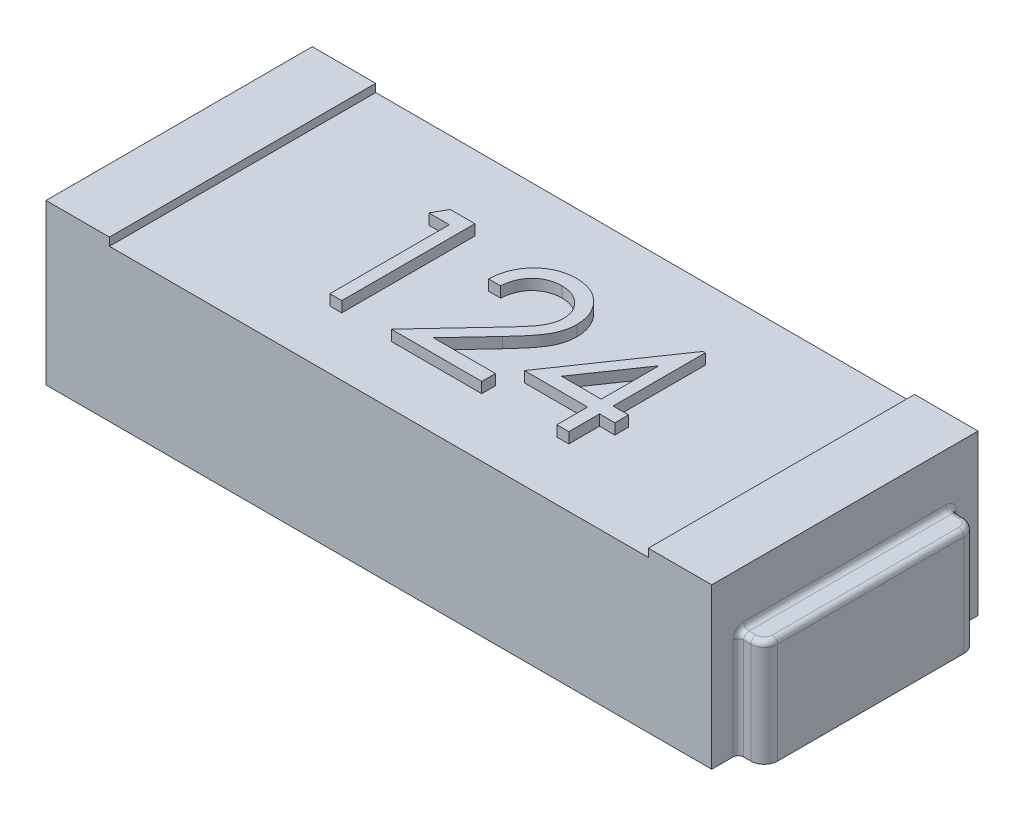
from build123d import *

# Parameters (mm, degrees)
ESQUISSE1_W             = 2.5
ESQUISSE1_H             = 1
BOSS_EXTRU_1_DEPTH      = 0.6
ESQUISSE2_W             = 2.023603034
ESQUISSE2_H             = 1
ENL_V_MAT_EXTRU_1_DEPTH = 0.03
BOSS_EXTRU_2_DEPTH      = 0.4
CONG_1_R                = 0.02
CONG_1_OF_SYM_TRIE2_R   = 0.02
BOSS_EXTRU_3_DEPTH      = 0.04


with BuildPart() as part:
    # Esquisse1 → Boss.-Extru.1 (new body)
    with BuildSketch(Plane(origin=(0, 0, 0), x_dir=(1, 0, 0), z_dir=(0, 1, 0))):
        Rectangle(ESQUISSE1_W, ESQUISSE1_H)
    extrude(amount=BOSS_EXTRU_1_DEPTH)

    # Esquisse2 → Enlèv. mat.-Extru.1 (cut)
    with BuildSketch(Plane(origin=(0, 0.6, 0), x_dir=(1, 0, 0), z_dir=(0, 1, 0))):
        Rectangle(ESQUISSE2_W, ESQUISSE2_H)
    extrude(amount=-ENL_V_MAT_EXTRU_1_DEPTH, mode=Mode.SUBTRACT)

    # Esquisse3 → Boss.-Extru.2 (add)
    with BuildSketch(Plane(origin=(0, 0, 0), x_dir=(1, 0, 0), z_dir=(0, 1, 0))):
        with BuildLine():
            Line((1.25, 0.4), (1.297141448, 0.4))
            ThreePointArc((1.297141448, 0.4), (1.332496787, 0.385355339), (1.347141448, 0.35))
            Line((1.347141448, 0.35), (1.347141448, -0.35))
            ThreePointArc((1.347141448, -0.35), (1.332496787, -0.385355339), (1.297141448, -0.4))
            Line((1.297141448, -0.4), (1.25, -0.4))
            Line((1.25, -0.4), (1.25, 0.4))
        make_face()
    boss_extru_2 = extrude(amount=BOSS_EXTRU_2_DEPTH)

    # Congé1
    cong_1_edges = [part.edges().sort_by_distance(p)[0] for p in [
        (1.25, 0.2, -0.4),
        (1.25, 0.2, 0.4),
        (1.25, 0.4, 0),
        (1.273570724, 0.4, 0.4),
        (1.332496787, 0.4, 0.385355339),
        (1.347141448, 0.4, 0),
        (1.332496787, 0.4, -0.385355339),
        (1.273570724, 0.4, -0.4),
    ]]
    fillet(cong_1_edges, radius=CONG_1_R)

    # Symétrie2: Boss.-Extru.2 across plane
    add(boss_extru_2.mirror(Plane(origin=(0, 0, 0), x_dir=(0, 0, 1), z_dir=(1, 0, 0))))

    # Congé1 of Symétrie2
    cong_1_of_sym_trie2_edges = [part.edges().sort_by_distance(p)[0] for p in [
        (-1.25, 0.2, -0.4),
        (-1.25, 0.2, 0.4),
        (-1.25, 0.4, 0),
        (-1.273570724, 0.4, 0.4),
        (-1.332496787, 0.4, 0.385355339),
        (-1.347141448, 0.4, 0),
        (-1.332496787, 0.4, -0.385355339),
        (-1.273570724, 0.4, -0.4),
    ]]
    fillet(cong_1_of_sym_trie2_edges, radius=CONG_1_OF_SYM_TRIE2_R)

    # Esquisse4 → Boss.-Extru.3 (add)
    # profile 1 of 3: a face of its own
    with BuildSketch(Plane(origin=(0, 0.57, 0), x_dir=(1, 0, 0), z_dir=(0, 1, 0))):
        Polygon((0.48447516, 0.23252099), (0.493589744, 0.23252099), (0.493589744, -0.113632856), (0.551282051, -0.113632856), (0.551282051, -0.164914907), (0.493589744, -0.164914907), (0.493589744, -0.280299523), (0.448717949, -0.280299523), (0.448717949, -0.164914907), (0.211538462, -0.164914907), align=None)
        Polygon((0.448717949, -0.113632856), (0.448717949, 0.10351458), (0.299679487, -0.113632856), align=None, mode=Mode.SUBTRACT)
    # profile 2 of 3: a face of its own
    with BuildSketch(Plane(origin=(0, 0.57, 0), x_dir=(1, 0, 0), z_dir=(0, 1, 0))):
        with BuildLine():
            Line((-0.108974359, 0.065854324), (-0.153846154, 0.065854324))
            add(Edge.make_bspline(
                [(-0.153846154, 0.065854324), (-0.153553703, 0.071807307), (-0.152979339, 0.08349881), (-0.150289583, 0.100545082), (-0.146440886, 0.116838625), (-0.14099925, 0.132248612), (-0.13424121, 0.146911299), (-0.126136921, 0.160768444), (-0.116537799, 0.173767185), (-0.105651123, 0.18578702), (-0.093827032, 0.196813816), (-0.08106904, 0.206335994), (-0.067662608, 0.214381375), (-0.053648408, 0.221107267), (-0.038868327, 0.226155816), (-0.023456491, 0.229901765), (-0.007345185, 0.232155528), (0.003631961, 0.232397784), (0.009214744, 0.23252099)],
                knots=[0, 0, 0, 0, 1.10065271, 2.161652631, 3.183658789, 4.190468796, 5.17591951, 6.163126047, 7.15150782, 8.156236427, 9.156009102, 10.134482811, 11.092018607, 12.041330605, 13.001268258, 13.972401359, 14.968799086, 16, 16, 16, 16], degree=3))
            add(Edge.make_bspline(
                [(0.009214744, 0.23252099), (0.014697326, 0.232392639), (0.025470403, 0.232140434), (0.041193548, 0.229974573), (0.056161733, 0.226582346), (0.0703457, 0.221823), (0.083632281, 0.215425225), (0.096121287, 0.207739862), (0.107961403, 0.198851315), (0.118619515, 0.188386485), (0.128406383, 0.177214715), (0.136849562, 0.165287872), (0.144080014, 0.152969403), (0.150106826, 0.140165374), (0.154543417, 0.126755227), (0.157911733, 0.112934198), (0.159815649, 0.098559225), (0.160107852, 0.088829717), (0.16025641, 0.08388317)],
                knots=[0, 0, 0, 0, 1.111607364, 2.184268762, 3.212621178, 4.221274766, 5.211760367, 6.196651075, 7.1921475, 8.207485113, 9.220403448, 10.201281604, 11.166441695, 12.114753415, 13.065576456, 14.026450734, 14.996634279, 16, 16, 16, 16], degree=3))
            add(Edge.make_bspline(
                [(0.16025641, 0.08388317), (0.160014516, 0.076919193), (0.159534971, 0.063113449), (0.155432917, 0.042825611), (0.149026273, 0.023169408), (0.141312365, 0.007349794), (0.133530587, -0.005397848), (0.126518086, -0.015893378), (0.118308827, -0.027194159), (0.108783327, -0.03926235), (0.098138631, -0.052192479), (0.086278322, -0.065976736), (0.073117825, -0.080472703), (0.063880896, -0.090373503), (0.059094551, -0.09550385)],
                knots=[0, 0, 0, 0, 1.184426356, 2.348067706, 3.509069118, 4.696110526, 5.333549288, 6.050745305, 6.844228056, 7.710549037, 8.667450064, 9.695053472, 10.805634456, 12, 12, 12, 12], degree=3))
            Line((0.059094551, -0.09550385), (-0.066005609, -0.229017471))
            Line((-0.066005609, -0.229017471), (0.166666667, -0.229017471))
            Line((0.166666667, -0.229017471), (0.166666667, -0.280299523))
            Line((0.166666667, -0.280299523), (-0.173076923, -0.280299523))
            Line((-0.173076923, -0.280299523), (0.020833333, -0.073368433))
            add(Edge.make_bspline(
                [(0.020833333, -0.073368433), (0.02555446, -0.068440103), (0.034622778, -0.058973791), (0.047448861, -0.045153368), (0.058968716, -0.032332005), (0.069256915, -0.020533927), (0.078090273, -0.00958656), (0.085929163, 0.000155541), (0.092209962, 0.009120462), (0.099026447, 0.019511978), (0.105628444, 0.032199452), (0.111301638, 0.047704265), (0.114760902, 0.063665301), (0.115175879, 0.074451306), (0.115384615, 0.079876759)],
                knots=[0, 0, 0, 0, 1.329631726, 2.553950428, 3.673215718, 4.687767853, 5.603093632, 6.413772471, 7.123043292, 7.734684054, 8.834405432, 9.900288307, 10.943827018, 12, 12, 12, 12], degree=3))
            add(Edge.make_bspline(
                [(0.115384615, 0.079876759), (0.115293795, 0.083288388), (0.115114806, 0.090012052), (0.113535135, 0.099870018), (0.111147919, 0.109379277), (0.107727168, 0.11856908), (0.10321192, 0.12734703), (0.097715723, 0.135723813), (0.091374285, 0.143822236), (0.084038389, 0.151415565), (0.075979601, 0.158370023), (0.067466137, 0.164530606), (0.058458979, 0.169679051), (0.048996104, 0.17389955), (0.039103894, 0.177210319), (0.028763216, 0.179504402), (0.018002643, 0.180944757), (0.010655, 0.181139638), (0.006911058, 0.181238939)],
                knots=[0, 0, 0, 0, 0.991446411, 1.95395049, 2.89581595, 3.838931463, 4.798493298, 5.75982156, 6.748411868, 7.785213223, 8.824556874, 9.840280684, 10.836137867, 11.835679398, 12.848801643, 13.863922112, 14.911575587, 16, 16, 16, 16], degree=3))
            add(Edge.make_bspline(
                [(0.006911058, 0.181238939), (0.003000939, 0.181136791), (-0.004677889, 0.180936191), (-0.015952037, 0.179532953), (-0.026707148, 0.177112119), (-0.036970277, 0.173801165), (-0.046758789, 0.169592801), (-0.056025081, 0.164351123), (-0.064748351, 0.158096338), (-0.072944997, 0.15100483), (-0.080496994, 0.143109459), (-0.087132262, 0.134308036), (-0.092929979, 0.124761262), (-0.097988441, 0.114494898), (-0.102096396, 0.103415786), (-0.105235418, 0.091563257), (-0.107719253, 0.078988774), (-0.108549042, 0.07030519), (-0.108974359, 0.065854324)],
                knots=[0, 0, 0, 0, 1.031018746, 2.02475058, 2.990194455, 3.934040569, 4.864654155, 5.795059489, 6.735614925, 7.690564532, 8.649604399, 9.611025574, 10.590972636, 11.591080095, 12.624614302, 13.701020113, 14.821632451, 16, 16, 16, 16], degree=3))
        make_face()
    # profile 3 of 3: a face of its own
    with BuildSketch(Plane(origin=(0, 0.57, 0), x_dir=(1, 0, 0), z_dir=(0, 1, 0))):
        Polygon((-0.451422276, 0.219700477), (-0.358974359, 0.219700477), (-0.358974359, -0.280299523), (-0.403846154, -0.280299523), (-0.403846154, 0.168418426), (-0.480769231, 0.168418426), align=None)
    extrude(amount=BOSS_EXTRU_3_DEPTH)


solid = part.part
